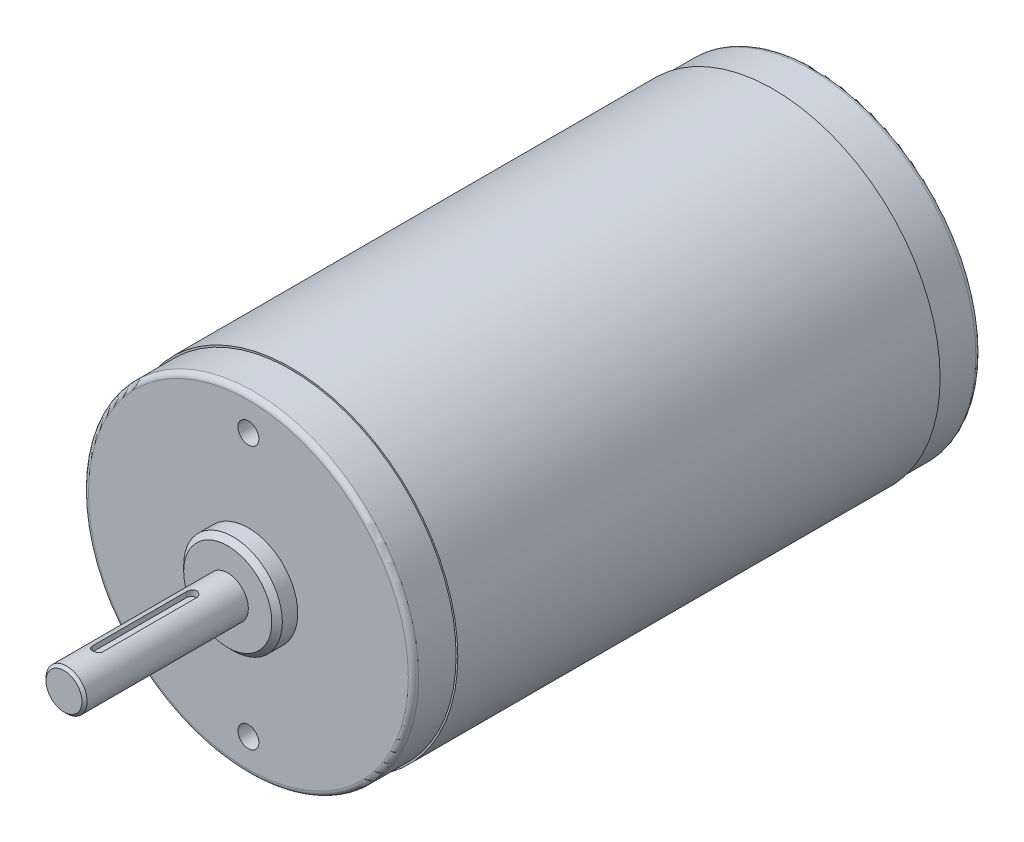
from build123d import *

# Parameters (mm, degrees)
FILLET1_R                     = 1
CHAMFER1_SIZE                 = 1.016
CHAMFER2_SIZE                 = 0.5
F_10_32_TAPPED_HOLE1_D        = 4.0386
F_10_32_TAPPED_HOLE1_DEPTH    = 13.6144
F_10_32_TAPPED_HOLE1_TIP      = 1.213317848
CUT_EXTRUDE1_START            = -6.79958
CUT_EXTRUDE1_DEPTH            = 122.301029095
SKETCH5_R                     = 4.318
BOSS_EXTRUDE1_DEPTH           = 2.2606
BOSS_EXTRUDE1_DRAFT           = 45
BOSS_EXTRUDE1_PROFILE_2_DEPTH = 2.2606
BOSS_EXTRUDE1_PROFILE_2_DRAFT = 45


with BuildPart() as part:
    # Sketch1 → Revolve1 (revolve)
    with BuildSketch(Plane(origin=(0, 0, 0), x_dir=(0, 0, -1), z_dir=(1, 0, 0)), mode=Mode.PRIVATE) as revolve1_sk:
        Polygon((-31.623, 0), (-31.623, 3.9751), (0, 3.9751), (0, 9.525), (3.9878, 9.525), (3.9878, 31.877), (12.2174, 31.877), (12.2174, 32.2072), (105.3592, 32.2072), (105.3592, 31.877), (113.5888, 31.877), (113.5888, 15.0368), (118.5888, 15.0368), (118.5888, 0), align=None)
    revolve(revolve1_sk.sketch.rotate(Axis((0, 0, 111.866494726), (0, 0, -1)), 90), axis=Axis((0, 0, 111.866494726), (0, 0, -1)))

    # Fillet1
    fillet1_edges = [part.edges().sort_by_distance(p)[0] for p in [
        (-31.877, 0, -113.5888),
        (-31.877, 0, -3.9878),
    ]]
    fillet(fillet1_edges, radius=FILLET1_R)

    # Chamfer1
    chamfer1_edges = [part.edges().sort_by_distance(p)[0] for p in [
        (-9.525, 0, 0),
        (-15.0368, 0, -118.5888),
    ]]
    chamfer(chamfer1_edges, length=CHAMFER1_SIZE)

    # Chamfer2
    chamfer2_edges = [part.edges().sort_by_distance(p)[0] for p in [
        (-3.9751, 0, 31.623),
    ]]
    chamfer(chamfer2_edges, length=CHAMFER2_SIZE)

    # #10-32 Tapped Hole1
    with Locations(Plane.XY):
        with Locations((0, 25.4), (0, -25.4)):
            Hole(F_10_32_TAPPED_HOLE1_D / 2, depth=F_10_32_TAPPED_HOLE1_DEPTH)
            with Locations((0, 0, -(F_10_32_TAPPED_HOLE1_DEPTH + F_10_32_TAPPED_HOLE1_TIP / 2))):  # 118° drill point
                Cone(0, F_10_32_TAPPED_HOLE1_D / 2, F_10_32_TAPPED_HOLE1_TIP, mode=Mode.SUBTRACT)

    # Sketch4 → Cut-Extrude1 (cut, through all)
    with BuildSketch(Plane(origin=(0, -3.9751, 0), x_dir=(-1, 0, 0), z_dir=(0, -1, 0)).offset(CUT_EXTRUDE1_START)):
        with BuildLine():
            Line((0.99949, -6.99389), (0.99949, -25.09393))
            ThreePointArc((0.99949, -25.09393), (0, -26.09342), (-0.99949, -25.09393))
            Line((-0.99949, -25.09393), (-0.99949, -6.99389))
            ThreePointArc((-0.99949, -6.99389), (0, -5.9944), (0.99949, -6.99389))
        make_face()
    extrude(amount=-CUT_EXTRUDE1_DEPTH, mode=Mode.SUBTRACT)


with BuildPart() as boss_extrude1_tool:
    # Sketch5 → Boss-Extrude1 (with draft: the straight prism first)
    with BuildSketch(Plane(origin=(0, 0, -113.5888), x_dir=(-1, 0, 0), z_dir=(0, 0, -1))):
        with Locations((11.185081873, 18.615102269)):
            Circle(SKETCH5_R)
    extrude(amount=BOSS_EXTRUDE1_DEPTH)
    # Boss-Extrude1: the draft: its side faces are tilted about the plane it starts from
    boss_extrude1_sides = [boss_extrude1_tool.faces().sort_by_distance(p)[0] for p in [
        (-6.867081873, 18.615102269, -114.7191),
    ]]
    draft(boss_extrude1_sides, Plane(origin=(0, 0, -113.5888), x_dir=(-1, 0, 0), z_dir=(0, 0, -1)), BOSS_EXTRUDE1_DRAFT)


with BuildPart() as part_1:
    add(part.part)

    # Boss-Extrude1: add boss_extrude1_tool
    add(boss_extrude1_tool.part)


with BuildPart() as boss_extrude1_profile_2_tool:
    # Sketch5 → Boss-Extrude1 profile 2 (with draft: the straight prism first)
    with BuildSketch(Plane(origin=(0, 0, -113.5888), x_dir=(-1, 0, 0), z_dir=(0, 0, -1))):
        with Locations((18.615102269, 11.185081873)):
            Circle(SKETCH5_R)
    extrude(amount=BOSS_EXTRUDE1_PROFILE_2_DEPTH)
    # Boss-Extrude1 profile 2: the draft: its side faces are tilted about the plane it starts from
    boss_extrude1_profile_2_sides = [boss_extrude1_profile_2_tool.faces().sort_by_distance(p)[0] for p in [
        (-14.297102269, 11.185081873, -114.7191),
    ]]
    draft(boss_extrude1_profile_2_sides, Plane(origin=(0, 0, -113.5888), x_dir=(-1, 0, 0), z_dir=(0, 0, -1)), BOSS_EXTRUDE1_PROFILE_2_DRAFT)


with BuildPart() as part_2:
    add(part_1.part)

    # Boss-Extrude1 profile 2: add boss_extrude1_profile_2_tool
    add(boss_extrude1_profile_2_tool.part)


solid = part_2.part
